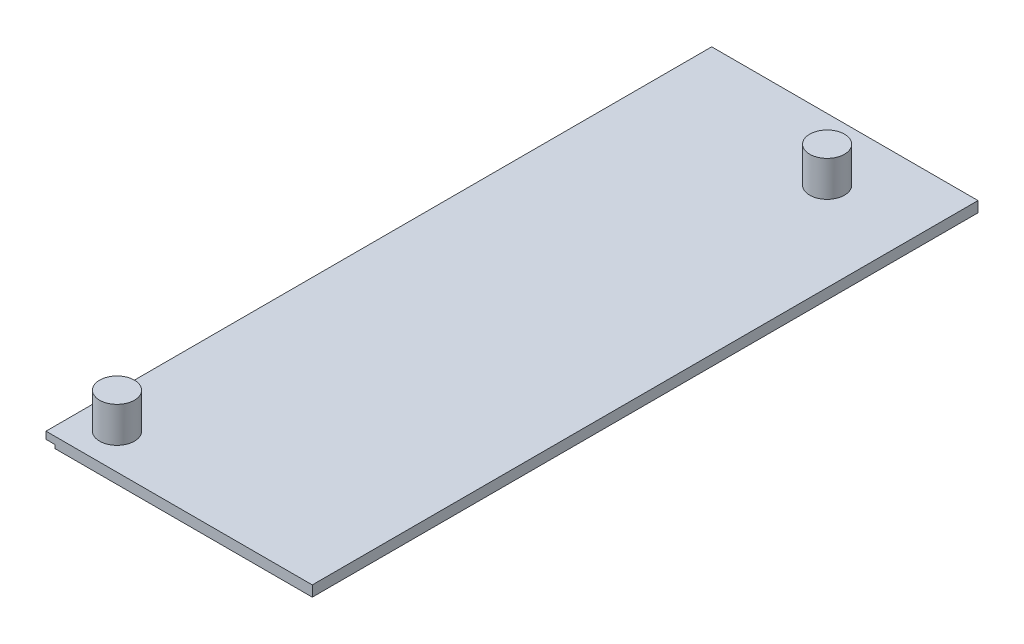
from build123d import *

# Parameters (mm, degrees)
SKETCH1_W           = 75
SKETCH1_H           = 3
BOSS_EXTRUDE1_DEPTH = 187.5
SKETCH2_R           = 4.9
BOSS_EXTRUDE2_DEPTH = 10
SKETCH3_W           = 7
SKETCH3_H           = 33
SKETCH3_W_2         = 2.5
SKETCH3_H_2         = 102.5
CUT_EXTRUDE1_DEPTH  = 1


with BuildPart() as part:
    # Sketch1 → Boss-Extrude1 (new body)
    with BuildSketch(Plane.XY):
        with Locations((37.5, 1.5)):
            Rectangle(SKETCH1_W, SKETCH1_H)
    extrude(amount=BOSS_EXTRUDE1_DEPTH)

    # Sketch2 → Boss-Extrude2 (add)
    with BuildSketch(Plane(origin=(0, 3, 0), x_dir=(1, 0, 0), z_dir=(0, 1, 0))):
        with Locations(Location((50, -17.5, 0), (0, 0, 90))):
            Circle(SKETCH2_R)
        with Locations(Location((10, -177.5, 0), (0, 0, 90))):
            Circle(SKETCH2_R)
    extrude(amount=BOSS_EXTRUDE2_DEPTH)

    # Sketch3 → Cut-Extrude1 (cut)
    with BuildSketch(Plane.XZ):
        with Locations((7.5, 26.5)):
            Rectangle(SKETCH3_W, SKETCH3_H)
        with Locations((7.5, 63.5)):
            Rectangle(SKETCH3_W, SKETCH3_H)
        with Locations((22.5, 26.5)):
            Rectangle(SKETCH3_W, SKETCH3_H)
        with Locations((22.5, 63.5)):
            Rectangle(SKETCH3_W, SKETCH3_H)
        with Locations((37.5, 26.5)):
            Rectangle(SKETCH3_W, SKETCH3_H)
        with Locations((37.5, 63.5)):
            Rectangle(SKETCH3_W, SKETCH3_H)
        with Locations((52.5, 26.5)):
            Rectangle(SKETCH3_W, SKETCH3_H)
        with Locations((52.5, 63.5)):
            Rectangle(SKETCH3_W, SKETCH3_H)
        with Locations((67.5, 26.5)):
            Rectangle(SKETCH3_W, SKETCH3_H)
        with Locations((67.5, 63.5)):
            Rectangle(SKETCH3_W, SKETCH3_H)
        with Locations((1.25, 136.25)):
            Rectangle(SKETCH3_W_2, SKETCH3_H_2)
    extrude(amount=-CUT_EXTRUDE1_DEPTH, mode=Mode.SUBTRACT)


solid = part.part
